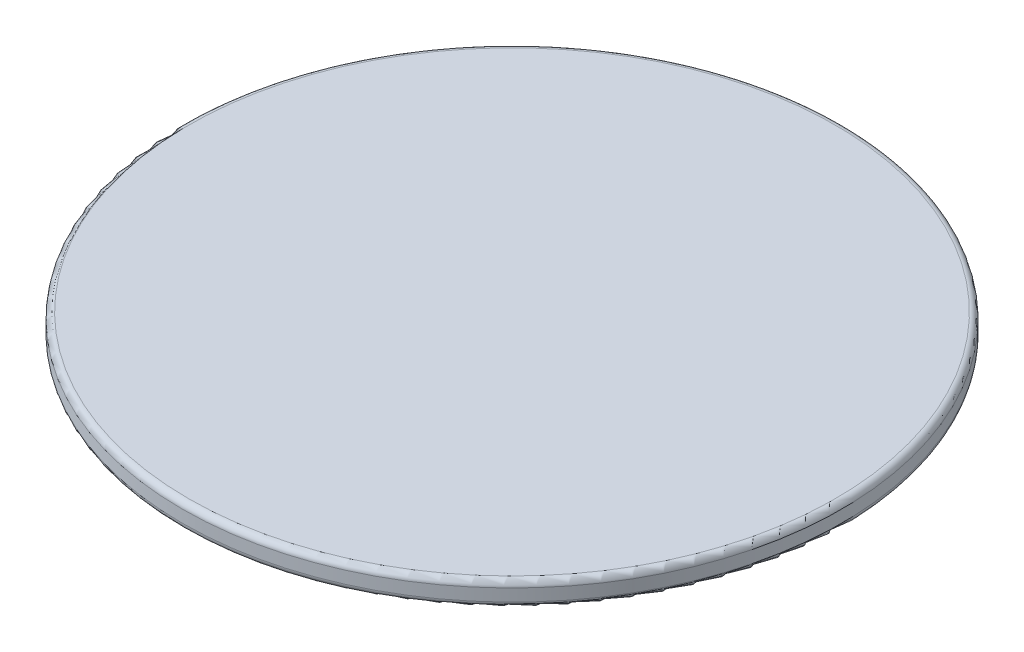
from build123d import *

# Parameters (mm, degrees)
SKETCH1_R           = 13.5
BOSS_EXTRUDE1_DEPTH = 1
FILLET1_R           = 0.25


with BuildPart() as part:
    # Sketch1 → Boss-Extrude1 (new body)
    with BuildSketch(Plane(origin=(0, 0, 0), x_dir=(1, 0, 0), z_dir=(0, 1, 0))):
        with Locations(Location((0, 0, 0), (0, 0, 270))):
            Circle(SKETCH1_R)
    extrude(amount=BOSS_EXTRUDE1_DEPTH)

    # Fillet1
    fillet1_edges = [part.edges().sort_by_distance(p)[0] for p in [
        (0, 0, -13.5),
        (0, 1, -13.5),
    ]]
    fillet(fillet1_edges, radius=FILLET1_R)


solid = part.part
